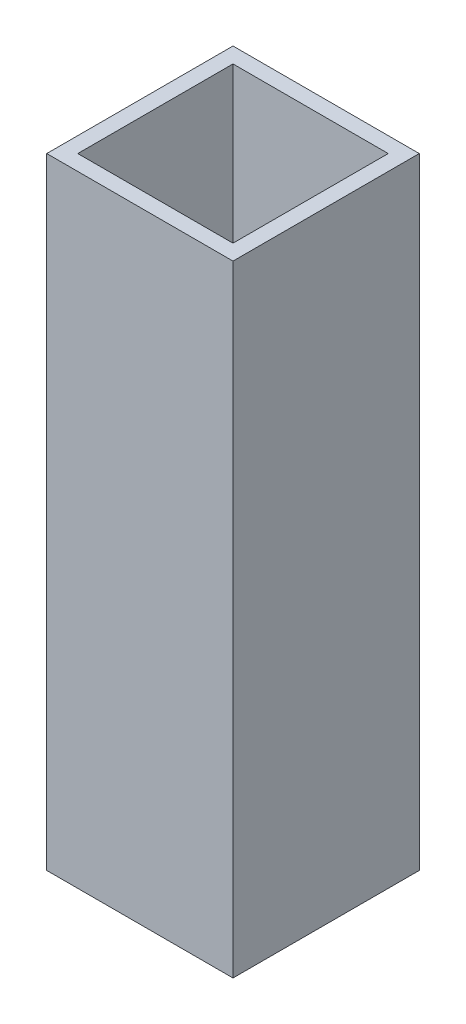
from build123d import *

# Parameters (mm, degrees)
CHANNEL_START              = 63.5
SKETCH1_W                  = 12
SKETCH1_H                  = 12
CHANNEL_DEPTH              = 40
LIGHT_PATH_10MM_DEPTH      = 106.585273594
LIGHT_PATH_10MM_DEPTH_BACK = 106.585273594
SKETCH2_W                  = 10
SKETCH2_H                  = 10


with BuildPart() as part:
    # Sketch1 → Channel (new body)
    with BuildSketch(Plane(origin=(0, 0, 0), x_dir=(1, 0, 0), z_dir=(0, 1, 0)).offset(CHANNEL_START)):
        with Locations((14, 0)):
            Rectangle(SKETCH1_W, SKETCH1_H)
    extrude(amount=CHANNEL_DEPTH)

    # Sketch2 → Light_Path_10mm (cut, two sides: drawn at the far end of the back side and taken through both)
    with BuildSketch(Plane(origin=(0, 0, 0), x_dir=(1, 0, 0), z_dir=(0, 1, 0)).offset(-LIGHT_PATH_10MM_DEPTH_BACK)):
        with Locations((14, 0)):
            Rectangle(SKETCH2_W, SKETCH2_H)
    extrude(amount=LIGHT_PATH_10MM_DEPTH + LIGHT_PATH_10MM_DEPTH_BACK, mode=Mode.SUBTRACT)


solid = part.part
